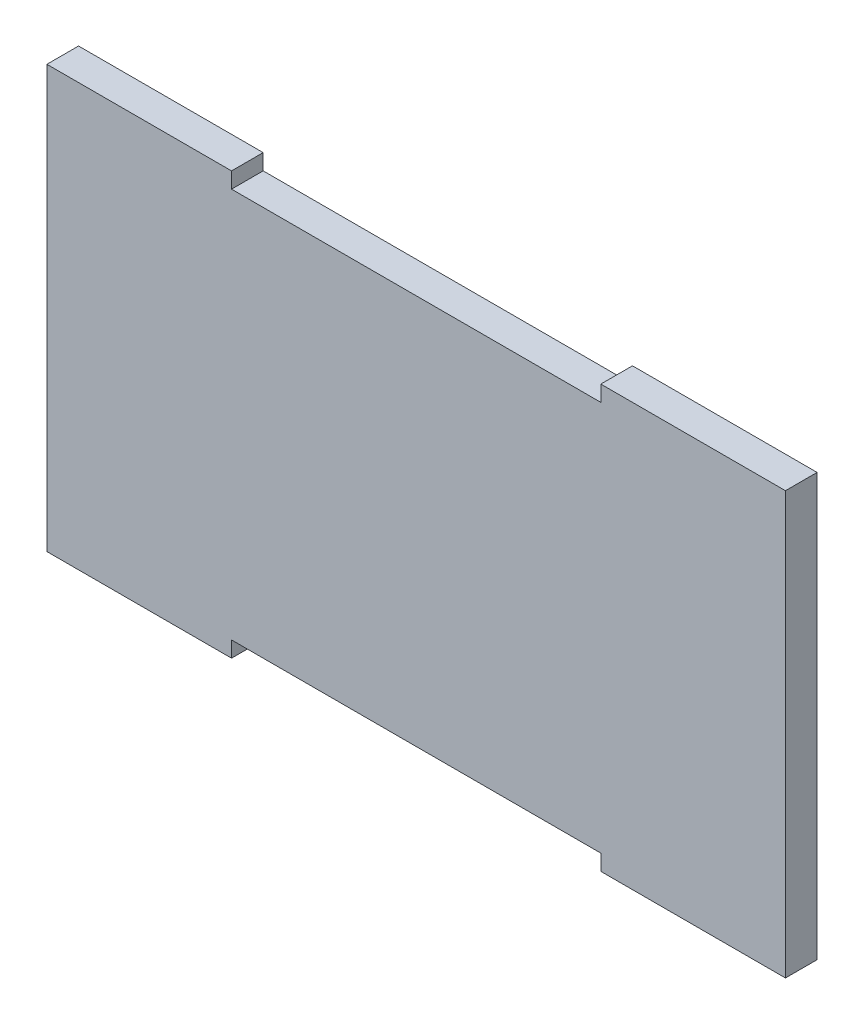
from build123d import *

# Parameters (mm, degrees)
RESSALTO_EXTRUS_O1_DEPTH = 6


with BuildPart() as part:
    # Esboço1 → Ressalto-extrusão1 (new body)
    with BuildSketch(Plane.XY):
        Polygon((70, -40), (70, 40), (35, 40), (35, 37), (-35, 37), (-35, 40), (-70, 40), (-70, -40), (-35, -40), (-35, -37), (35, -37), (35, -40), align=None)
    extrude(amount=RESSALTO_EXTRUS_O1_DEPTH)


solid = part.part
